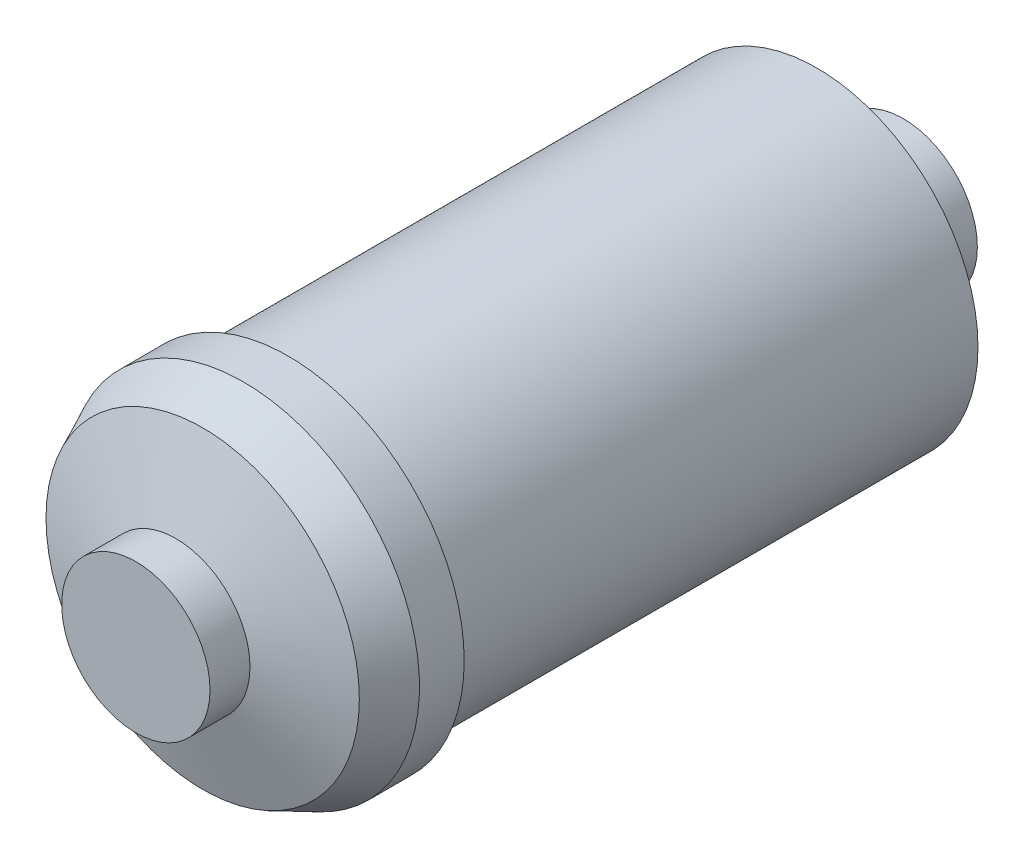
from build123d import *

# Parameters (mm, degrees)
SKETCH1_R           = 14.732
BOSS_EXTRUDE1_DEPTH = 8.255
SKETCH2_R           = 14.732
SKETCH3_R           = 32.004
SKETCH4_R           = 32.004
BOSS_EXTRUDE2_DEPTH = 104.9655
SKETCH5_R           = 34.925
BOSS_EXTRUDE3_DEPTH = 8.89
SKETCH6_R           = 34.925
SKETCH7_R           = 31.115
SKETCH8_R           = 31.115
SKETCH9_R           = 14.732
SKETCH10_R          = 14.732
BOSS_EXTRUDE4_DEPTH = 7.9375


with BuildPart() as part:
    # Sketch1 → Boss-Extrude1 (new body)
    with BuildSketch(Plane.XY):
        Circle(SKETCH1_R)
    extrude(amount=BOSS_EXTRUDE1_DEPTH)

    # Sketch2 → Loft1 section 0
    with BuildSketch(Plane.XY.offset(8.255)):
        Circle(SKETCH2_R)
    # Sketch3 → Loft1 section 1
    with BuildSketch(Plane.XY.offset(17.145)):
        Circle(SKETCH3_R)
    loft()

    # Sketch4 → Boss-Extrude2 (add)
    with BuildSketch(Plane.XY.offset(17.145)):
        Circle(SKETCH4_R)
    extrude(amount=BOSS_EXTRUDE2_DEPTH)

    # Sketch5 → Boss-Extrude3 (add)
    with BuildSketch(Plane.XY.offset(122.1105)):
        Circle(SKETCH5_R)
    extrude(amount=BOSS_EXTRUDE3_DEPTH)

    # Sketch6 → Loft2 section 0
    with BuildSketch(Plane.XY.offset(131.0005)):
        Circle(SKETCH6_R)
    # Sketch7 → Loft2 section 1
    with BuildSketch(Plane.XY.offset(139.1285)):
        Circle(SKETCH7_R)
    loft()

    # Sketch8 → Loft3 section 0
    with BuildSketch(Plane.XY.offset(139.1285)):
        Circle(SKETCH8_R)
    # Sketch9 → Loft3 section 1
    with BuildSketch(Plane.XY.offset(144.4625)):
        Circle(SKETCH9_R)
    loft()

    # Sketch10 → Boss-Extrude4 (add)
    with BuildSketch(Plane.XY.offset(144.4625)):
        Circle(SKETCH10_R)
    extrude(amount=BOSS_EXTRUDE4_DEPTH)


solid = part.part
